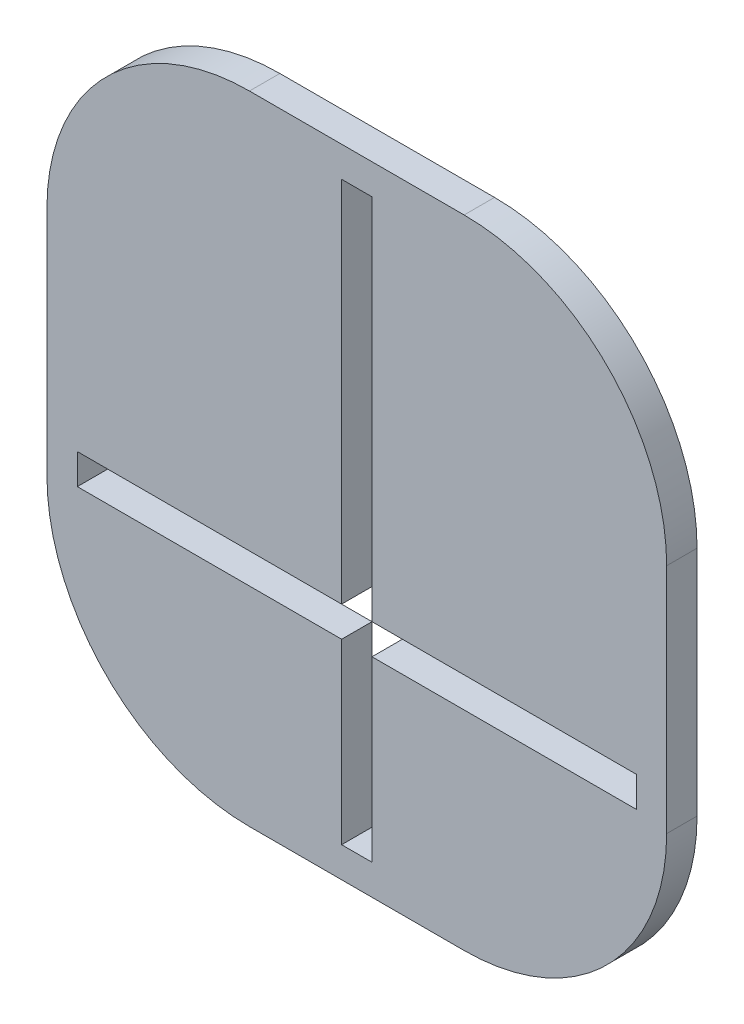
from build123d import *

# Parameters (mm, degrees)
SALIENTE_EXTRUIR1_DEPTH = 3


with BuildPart() as part:
    # Croquis1 → Saliente-Extruir1 (new body)
    with BuildSketch(Plane.XY):
        with BuildLine():
            Line((-10.6, -31.455), (10.6, -31.455))
            ThreePointArc((10.6, -31.455), (24.742135624, -25.597135624), (30.6, -11.455))
            Line((30.6, -11.455), (30.6, 11.455))
            ThreePointArc((30.6, 11.455), (24.742135624, 25.597135624), (10.6, 31.455))
            Line((10.6, 31.455), (-10.6, 31.455))
            ThreePointArc((-10.6, 31.455), (-24.742135624, 25.597135624), (-30.6, 11.455))
            Line((-30.6, 11.455), (-30.6, -11.455))
            ThreePointArc((-30.6, -11.455), (-24.742135624, -25.597135624), (-10.6, -31.455))
        make_face()
        Polygon((-27.6, -10.88), (-27.6, -7.88), (-1.5, -7.88), (-1.5, 28.455), (1.5, 28.455), (1.5, -7.88), (27.6, -7.88), (27.6, -10.88), (1.5, -10.88), (1.5, -28.455), (-1.5, -28.455), (-1.5, -10.88), align=None, mode=Mode.SUBTRACT)
    extrude(amount=SALIENTE_EXTRUIR1_DEPTH)


solid = part.part
